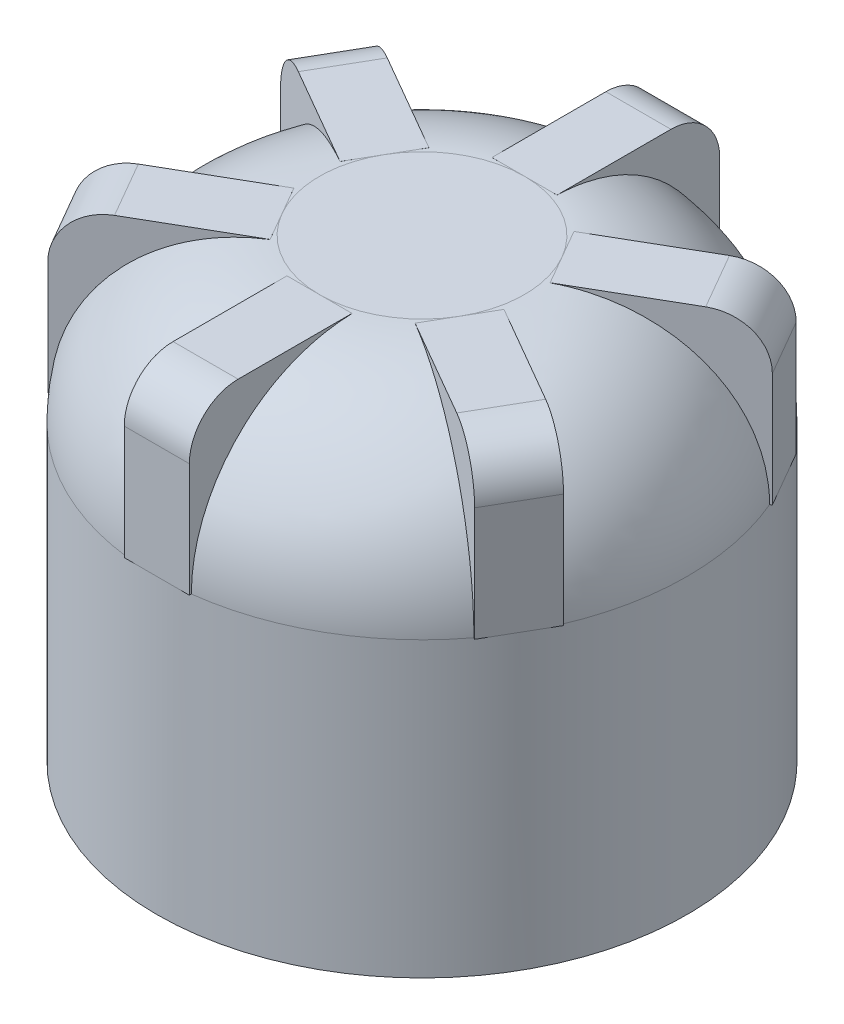
from build123d import *

# Parameters (mm, degrees)
SKETCH1_R           = 16.3
BOSS_EXTRUDE1_DEPTH = 28
FILLET1_R           = 10
SKETCH4_R           = 5.2
SKETCH5_R           = 3.05
SKETCH6_R           = 3.05
CUT_EXTRUDE1_DEPTH  = 9
BOSS_EXTRUDE3_START = 9
BOSS_EXTRUDE3_DEPTH = 9
BOSS_EXTRUDE4_DEPTH = 10
CIRPATTERN1_COUNT   = 6
FILLET2_R           = 3


with BuildPart() as part:
    # Sketch1 → Boss-Extrude1 (new body)
    with BuildSketch(Plane(origin=(0, 0, 0), x_dir=(1, 0, 0), z_dir=(0, 1, 0))):
        with Locations(Location((0, 0, 0), (0, 0, 270))):
            Circle(SKETCH1_R)
    extrude(amount=BOSS_EXTRUDE1_DEPTH)

    # Fillet1
    fillet1_edges = [part.edges().sort_by_distance(p)[0] for p in [
        (0, 28, -16.3),
    ]]
    fillet(fillet1_edges, radius=FILLET1_R)

    # Sketch4 → Cut-Loft1 section 0
    with BuildSketch(Plane.XZ):
        Circle(SKETCH4_R)
    # Sketch5 → Cut-Loft1 section 1
    with BuildSketch(Plane(origin=(0, 7, 0), x_dir=(-1, 0, 0), z_dir=(0, -1, 0))):
        Circle(SKETCH5_R)
    loft(mode=Mode.SUBTRACT)

    # Sketch6 → Cut-Extrude1 (cut)
    with BuildSketch(Plane.XZ.offset(-7)):
        with Locations(Location((0, 0, 0), (0, 0, 270))):
            Circle(SKETCH6_R)
    extrude(amount=-CUT_EXTRUDE1_DEPTH, mode=Mode.SUBTRACT)

    # Sketch7 → Boss-Extrude3 (add)
    with BuildSketch(Plane.XZ.offset(-16).offset(BOSS_EXTRUDE3_START)):
        with BuildLine():
            Line((-2.424871131, 1.85), (2.424871131, 1.85))
            ThreePointArc((2.424871131, 1.85), (0, 3.05), (-2.424871131, 1.85))
        make_face()
    extrude(amount=-BOSS_EXTRUDE3_DEPTH)

    # Sketch8 → Boss-Extrude4 (add)
    with BuildSketch(Plane(origin=(0, 18, 0), x_dir=(-1, 0, 0), z_dir=(0, -1, 0))):
        Polygon((0, 6.3), (-2, 6.3), (-2, 16.3), (0, 16.3), (2, 16.3), (2, 6.3), align=None)
    boss_extrude4 = extrude(amount=-BOSS_EXTRUDE4_DEPTH)

    # CirPattern1: Boss-Extrude4 ×6 about axis
    cirpattern1_axis = Axis((0, 0, 0), (0, 1, 0))
    for i in range(1, CIRPATTERN1_COUNT):
        add(boss_extrude4.rotate(cirpattern1_axis, i * 360 / CIRPATTERN1_COUNT))

    # Fillet2
    fillet2_edges = [part.edges().sort_by_distance(p)[0] for p in [
        (14.116214082, 28, 8.15),
        (14.116214082, 28, -8.15),
        (0, 28, -16.3),
        (-14.116214082, 28, -8.15),
        (-14.116214082, 28, 8.15),
        (0, 28, 16.3),
    ]]
    fillet(fillet2_edges, radius=FILLET2_R)


solid = part.part
